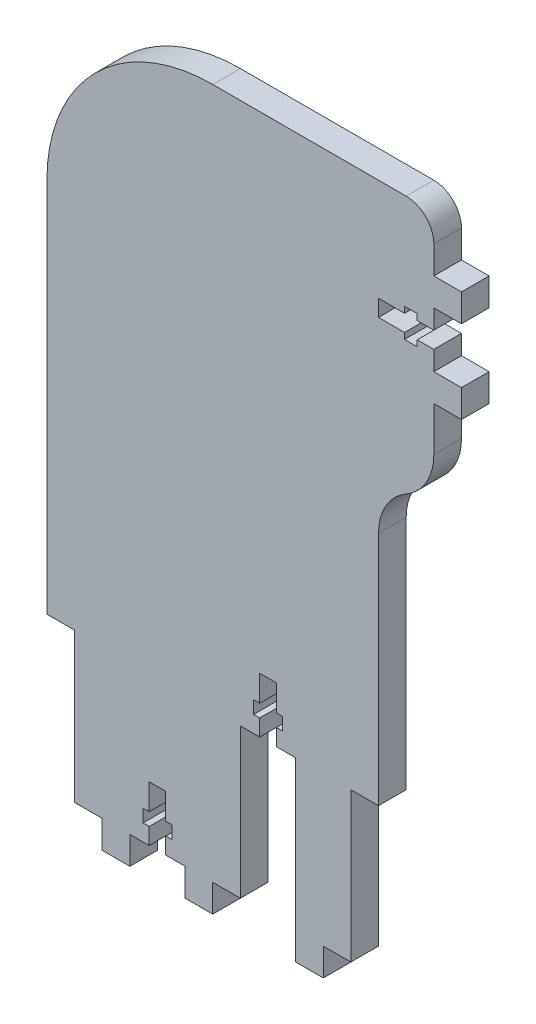
from build123d import *

# Parameters (mm, degrees)
BOSS_EXTRU_1_DEPTH = 5


with BuildPart() as part:
    # Esquisse1 → Boss.-Extru.1 (new body)
    with BuildSketch(Plane.XY):
        with BuildLine():
            Line((-10, 0), (-10, -42.679491924))
            Line((-10, -42.679491924), (-15, -42.679491924))
            Line((-15, -42.679491924), (-15, -69.679491924))
            Line((-15, -69.679491924), (-20, -69.679491924))
            Line((-20, -69.679491924), (-20, -74.679491924))
            Line((-20, -74.679491924), (-25, -74.679491924))
            Line((-25, -74.679491924), (-25, -42.679491924))
            Line((-25, -42.679491924), (-28.5, -42.679491924))
            Line((-28.5, -42.679491924), (-28.5, -39.679491924))
            Line((-28.5, -39.679491924), (-27.4, -39.679491924))
            Line((-27.4, -39.679491924), (-27.4, -37.379491924))
            Line((-27.4, -37.379491924), (-28.5, -37.379491924))
            Line((-28.5, -37.379491924), (-28.5, -32.679491924))
            Line((-28.5, -32.679491924), (-31.5, -32.679491924))
            Line((-31.5, -32.679491924), (-31.5, -37.379491924))
            Line((-31.5, -37.379491924), (-32.6, -37.379491924))
            Line((-32.6, -37.379491924), (-32.6, -39.679491924))
            Line((-32.6, -39.679491924), (-31.5, -39.679491924))
            Line((-31.5, -39.679491924), (-31.5, -42.679491924))
            Line((-31.5, -42.679491924), (-35, -42.679491924))
            Line((-35, -42.679491924), (-35, -69.679491924))
            Line((-35, -69.679491924), (-40, -69.679491924))
            Line((-40, -69.679491924), (-40, -74.679491924))
            Line((-40, -74.679491924), (-45, -74.679491924))
            Line((-45, -74.679491924), (-45, -69.679491924))
            Line((-45, -69.679491924), (-48.5, -69.679491924))
            Line((-48.5, -69.679491924), (-48.5, -66.679491924))
            Line((-48.5, -66.679491924), (-47.4, -66.679491924))
            Line((-47.4, -66.679491924), (-47.4, -64.379491924))
            Line((-47.4, -64.379491924), (-48.5, -64.379491924))
            Line((-48.5, -64.379491924), (-48.5, -59.679491924))
            Line((-48.5, -59.679491924), (-51.5, -59.679491924))
            Line((-51.5, -59.679491924), (-51.5, -64.379491924))
            Line((-51.5, -64.379491924), (-52.6, -64.379491924))
            Line((-52.6, -64.379491924), (-52.6, -66.679491924))
            Line((-52.6, -66.679491924), (-51.5, -66.679491924))
            Line((-51.5, -66.679491924), (-51.5, -69.679491924))
            Line((-51.5, -69.679491924), (-55, -69.679491924))
            Line((-55, -69.679491924), (-55, -74.679491924))
            Line((-55, -74.679491924), (-60, -74.679491924))
            Line((-60, -74.679491924), (-60, -69.679491924))
            Line((-60, -69.679491924), (-65, -69.679491924))
            Line((-65, -69.679491924), (-65, -42.679491924))
            Line((-65, -42.679491924), (-70, -42.679491924))
            Line((-70, -42.679491924), (-70, 25.320508076))
            ThreePointArc((-70, 25.320508076), (-61.213203436, 46.533711511), (-40, 55.320508076))
            Line((-40, 55.320508076), (-5, 55.320508076))
            ThreePointArc((-5, 55.320508076), (-1.464466094, 53.856041982), (0, 50.320508076))
            Line((0, 50.320508076), (0, 45.320508076))
            Line((0, 45.320508076), (5, 45.320508076))
            Line((5, 45.320508076), (5, 40.320508076))
            Line((5, 40.320508076), (0, 40.320508076))
            Line((0, 40.320508076), (0, 36.820508076))
            Line((0, 36.820508076), (-3, 36.820508076))
            Line((-3, 36.820508076), (-3, 37.920508076))
            Line((-3, 37.920508076), (-5.3, 37.920508076))
            Line((-5.3, 37.920508076), (-5.3, 36.820508076))
            Line((-5.3, 36.820508076), (-10, 36.820508076))
            Line((-10, 36.820508076), (-10, 33.820508076))
            Line((-10, 33.820508076), (-5.3, 33.820508076))
            Line((-5.3, 33.820508076), (-5.3, 32.720508076))
            Line((-5.3, 32.720508076), (-3, 32.720508076))
            Line((-3, 32.720508076), (-3, 33.820508076))
            Line((-3, 33.820508076), (0, 33.820508076))
            Line((0, 33.820508076), (0, 30.320508076))
            Line((0, 30.320508076), (5, 30.320508076))
            Line((5, 30.320508076), (5, 25.320508076))
            Line((5, 25.320508076), (0, 25.320508076))
            Line((0, 25.320508076), (0, 17.320508076))
            ThreePointArc((0, 17.320508076), (-1.339745962, 12.320508076), (-5, 8.660254038))
            ThreePointArc((-5, 8.660254038), (-8.660254038, 5), (-10, 0))
        make_face()
    extrude(amount=BOSS_EXTRU_1_DEPTH)


solid = part.part
